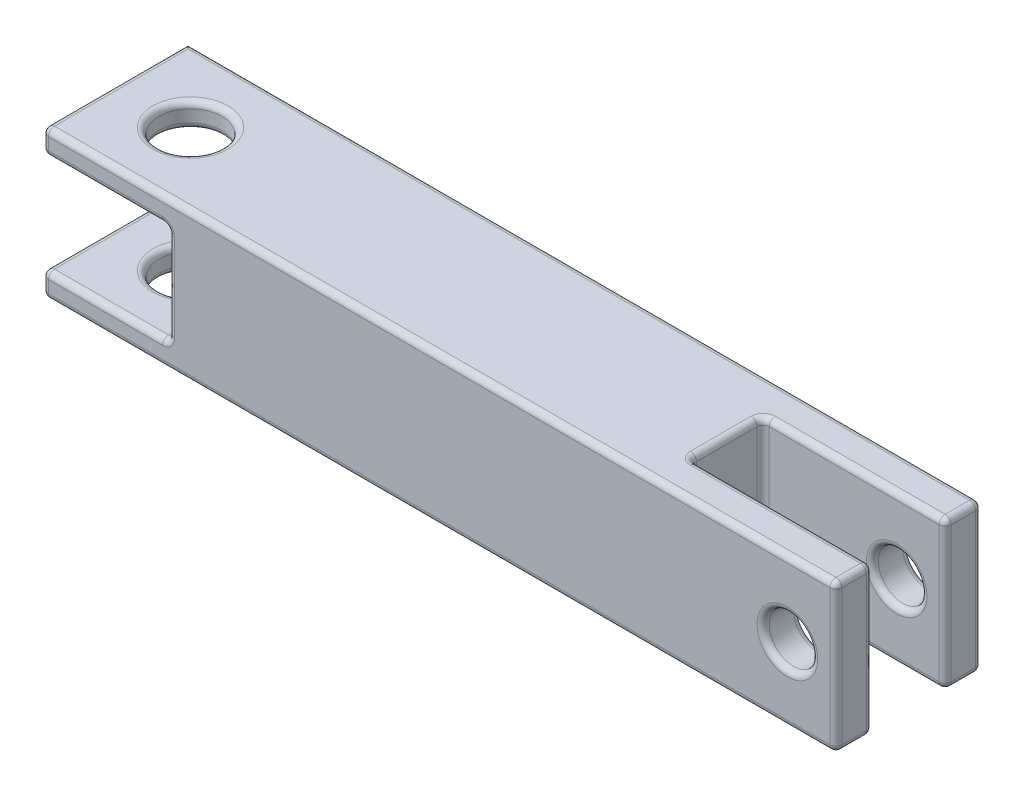
from build123d import *

# Parameters (mm, degrees)
BOSS_EXTRUDE1_DEPTH     = 12
CUT_EXTRUDE1_DEPTH      = 21.024984395
CUT_EXTRUDE1_DEPTH_BACK = 21.024984395
SKETCH2_R               = 2.6
SKETCH3_W               = 12
SKETCH3_H               = 12.2
BOSS_EXTRUDE2_DEPTH     = 53
CUT_EXTRUDE2_DEPTH      = 67.771026651
CUT_EXTRUDE2_DEPTH_BACK = 15
SKETCH4_W               = 6
SKETCH4_H               = 12.2
SKETCH5_R               = 2
CUT_EXTRUDE3_DEPTH      = 57.623405055
FILLET1_R               = 0.5


with BuildPart() as part:
    # Sketch1 → Boss-Extrude1 (new body)
    with BuildSketch(Plane.XY):
        Polygon((0, 4.1), (0, -4.1), (-10.4, -4.1), (-10.4, -6.1), (2, -6.1), (2, 6.1), (-10.4, 6.1), (-10.4, 4.1), align=None)
    extrude(amount=BOSS_EXTRUDE1_DEPTH)

    # Sketch2 → Cut-Extrude1 (cut, two sides: drawn at the far end of the back side and taken through both)
    with BuildSketch(Plane(origin=(0, 6.1, 0), x_dir=(1, 0, 0), z_dir=(0, 1, 0)).offset(-CUT_EXTRUDE1_DEPTH_BACK)):
        with Locations(Location((-4.2, -6, 0), (0, 0, 180))):
            Circle(SKETCH2_R)
    extrude(amount=CUT_EXTRUDE1_DEPTH + CUT_EXTRUDE1_DEPTH_BACK, mode=Mode.SUBTRACT)

    # Sketch3 → Boss-Extrude2 (add)
    with BuildSketch(Plane(origin=(2, 0, 0), x_dir=(0, 0, -1), z_dir=(1, 0, 0))):
        with Locations((-6, 0)):
            Rectangle(SKETCH3_W, SKETCH3_H)
    extrude(amount=BOSS_EXTRUDE2_DEPTH)

    # Sketch4 → Cut-Extrude2 (cut, two sides: drawn at the far end of the back side and taken through both)
    with BuildSketch(Plane(origin=(55, 0, 0), x_dir=(0, 0, -1), z_dir=(1, 0, 0)).offset(-CUT_EXTRUDE2_DEPTH_BACK)):
        with Locations((-6, 0)):
            Rectangle(SKETCH4_W, SKETCH4_H)
    extrude(amount=CUT_EXTRUDE2_DEPTH + CUT_EXTRUDE2_DEPTH_BACK, mode=Mode.SUBTRACT)

    # Sketch5 → Cut-Extrude3 (cut, through all)
    with BuildSketch(Plane.XY.offset(12)):
        with Locations((51, 0)):
            Circle(SKETCH5_R)
    extrude(amount=-CUT_EXTRUDE3_DEPTH, mode=Mode.SUBTRACT)

    # Fillet1
    fillet1_edges = [part.edges().sort_by_distance(p)[0] for p in [
        (22.3, -6.1, 0),
        (-5.2, -4.1, 0),
        (22.3, -6.1, 12),
        (0, -4.1, 6),
        (0, 4.1, 6),
        (-10.4, 4.1, 6),
        (-10.4, 6.1, 6),
        (-10.4, -6.1, 6),
        (-10.4, -4.1, 6),
        (22.3, 6.1, 12),
        (-10.4, 5.1, 12),
        (-1.6, -6.1, 6),
        (-1.6, -4.1, 6),
        (-1.6, 4.1, 6),
        (-1.6, 6.1, 6),
        (-5.2, 4.1, 12),
        (0, 0, 12),
        (55, 0, 12),
        (55, -6.1, 10.5),
        (55, 0, 0),
        (55, 6.1, 1.5),
        (55, -6.1, 1.5),
        (55, 6.1, 10.5),
        (55, 0, 3),
        (55, 0, 9),
        (-5.2, -4.1, 12),
        (47.5, 6.1, 9),
        (40, 0, 9),
        (47.5, -6.1, 9),
        (40, -6.1, 6),
        (47.5, -6.1, 3),
        (40, 0, 3),
        (47.5, 6.1, 3),
        (40, 6.1, 6),
        (49, 0, 3),
        (49, 0, 9),
        (49, 0, 0),
        (49, 0, 12),
        (0, 0, 0),
        (-10.4, -5.1, 12),
        (-5.2, 4.1, 0),
        (22.3, 6.1, 0),
    ]]
    fillet(fillet1_edges, radius=FILLET1_R)


solid = part.part
